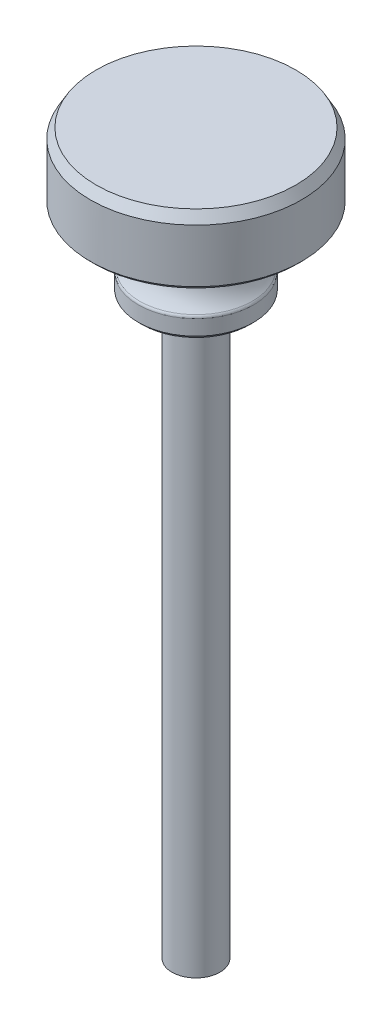
from build123d import *

# Parameters (mm, degrees)
SKETCH1_W      = 12.5
SKETCH1_H      = 300
CHAMFER1_SIZE  = 3
CHAMFER1_SIZE2 = 5.196152423
CHAMFER2_SIZE  = 2
CHAMFER3_SIZE  = 2
FILLET1_R      = 2
FILLET2_R      = 2
SCALE1_SCALE   = 0.1


with BuildPart() as part:
    # Sketch1 → Revolve1 (revolve)
    with BuildSketch(Plane.XY, mode=Mode.PRIVATE) as revolve1_sk:
        with Locations((6.25, -48.713790357)):
            Rectangle(SKETCH1_W, SKETCH1_H)
    revolve(revolve1_sk.sketch.rotate(Axis((0, 0, 0), (0, 1, 0)), 90), axis=Axis((0, 0, 0), (0, 1, 0)))

    # Sketch2 → Revolve2 (revolve)
    with BuildSketch(Plane.XY, mode=Mode.PRIVATE) as revolve2_sk:
        with BuildLine():
            Line((0, 101.286209643), (12.5, 101.286209643))
            Line((12.5, 101.286209643), (30, 101.286209643))
            Line((30, 101.286209643), (30, 112.044433041))
            ThreePointArc((30, 112.044433041), (23.556624576, 126.665321342), (30, 141.286209643))
            Line((30, 141.286209643), (55, 141.286209643))
            Line((55, 141.286209643), (55, 176.286209643))
            Line((55, 176.286209643), (0, 176.286209643))
            Line((0, 176.286209643), (0, 101.286209643))
        make_face()
    revolve(revolve2_sk.sketch.rotate(Axis((0, 0, 0), (0, 1, 0)), 90), axis=Axis((0, 0, 0), (0, 1, 0)))

    # Chamfer1
    chamfer1_edges = [part.edges().sort_by_distance(p)[0] for p in [
        (0, 176.286209643, 55),
    ]]
    chamfer1_side = [part.faces().sort_by_distance(p)[0] for p in [
        (0, 176.286209643, 0),
    ]]
    chamfer(chamfer1_edges, length=CHAMFER1_SIZE, length2=CHAMFER1_SIZE2, reference=chamfer1_side[0])

    # Chamfer2
    chamfer2_edges = [part.edges().sort_by_distance(p)[0] for p in [
        (0, 141.286209643, 55),
    ]]
    chamfer(chamfer2_edges, length=CHAMFER2_SIZE)

    # Chamfer3
    chamfer3_edges = [part.edges().sort_by_distance(p)[0] for p in [
        (0, 101.286209643, 30),
    ]]
    chamfer(chamfer3_edges, length=CHAMFER3_SIZE)

    # Fillet1
    fillet1_edges = [part.edges().sort_by_distance(p)[0] for p in [
        (0, 112.044433041, 30),
    ]]
    fillet(fillet1_edges, radius=FILLET1_R)

    # Fillet2
    fillet2_edges = [part.edges().sort_by_distance(p)[0] for p in [
        (0, 141.286209643, 30),
    ]]
    fillet(fillet2_edges, radius=FILLET2_R)


with BuildPart() as part_1:
    # Scale1: scaled about (0, 98.653209901, -1.6e-08)
    add(part.part.scale(SCALE1_SCALE).moved(Location((0, 88.787888911, -1.4e-08))))


solid = part_1.part
